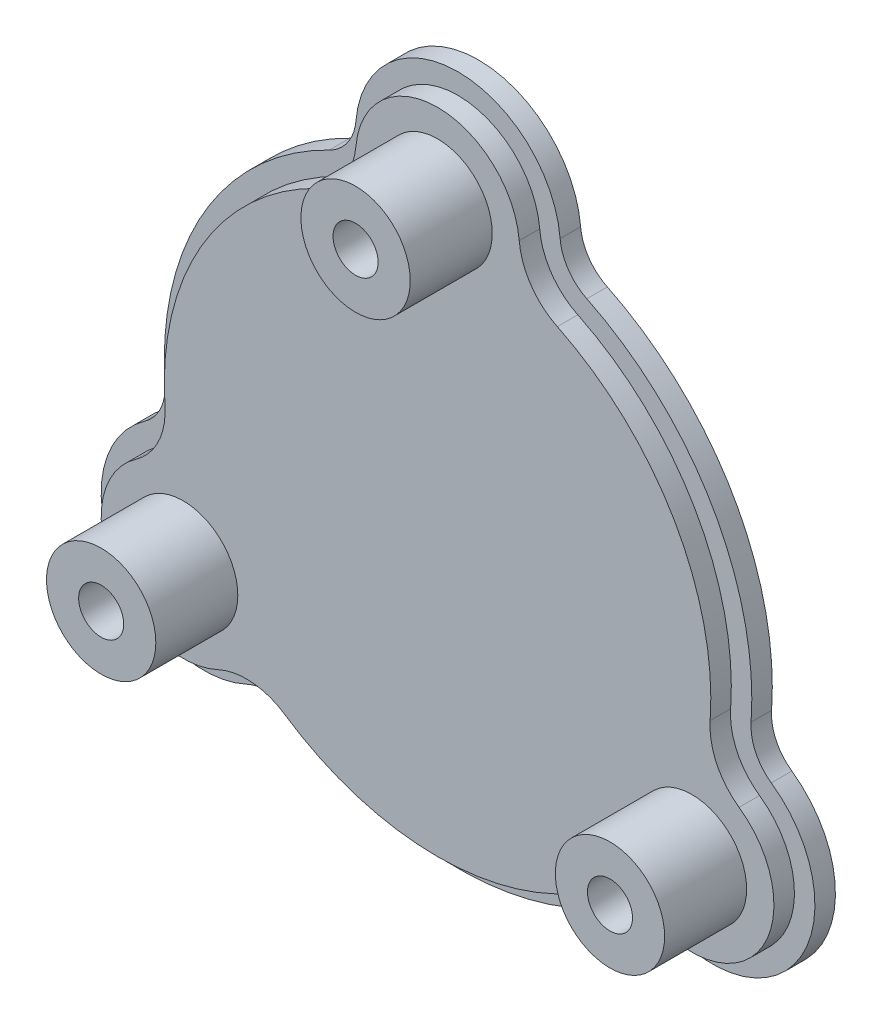
from build123d import *

# Parameters (mm, degrees)
BOSS_EXTRUDE1_DEPTH = 3
SKETCH1_3_R         = 8
BOSS_EXTRUDE2_DEPTH = 6
SKETCH1_5_R         = 8
SKETCH1_5_R_2       = 3.3
BOSS_EXTRUDE4_DEPTH = 18


with BuildPart() as part:
    # Sketch1 → Boss-Extrude1 (new body)
    with BuildSketch(Plane.XY):
        with BuildLine():
            ThreePointArc((-14.941453584, 44.323995772), (-16.147655157, 40.973517522), (-18.846153454, 38.65))
            ThreePointArc((-18.846153454, 38.65), (-37.239092363, 21.5), (-42.894958583, -3.003752345))
            ThreePointArc((-42.894958583, -3.003752345), (-43.557934635, -6.502479184), (-45.856433127, -9.222319513))
            ThreePointArc((-45.856433127, -9.222319513), (-50.229473419, -29), (-30.914979544, -35.101676259))
            ThreePointArc((-30.914979544, -35.101676259), (-27.410279478, -34.471038339), (-24.048805129, -35.646247655))
            ThreePointArc((-24.048805129, -35.646247655), (0, -43), (24.048805129, -35.646247655))
            ThreePointArc((24.048805129, -35.646247655), (27.410279478, -34.471038339), (30.914979544, -35.101676259))
            ThreePointArc((30.914979544, -35.101676259), (50.229473419, -29), (45.856433127, -9.222319513))
            ThreePointArc((45.856433127, -9.222319513), (43.557934635, -6.502479184), (42.894958583, -3.003752345))
            ThreePointArc((42.894958583, -3.003752345), (37.239092363, 21.5), (18.846153454, 38.65))
            ThreePointArc((18.846153454, 38.65), (16.147655157, 40.973517523), (14.941453584, 44.323995772))
            ThreePointArc((14.941453584, 44.323995772), (0, 58), (-14.941453584, 44.323995772))
        make_face()
        with BuildLine():
            ThreePointArc((-39.902287054, -2.794188228), (-34.641016151, 20), (-17.531305538, 35.953488372))
            ThreePointArc((-17.531305538, 35.953488372), (-13.676307972, 39.272799119), (-11.953162867, 44.059196617))
            ThreePointArc((-11.953162867, 44.059196617), (0, 55), (11.953162867, 44.059196617))
            ThreePointArc((11.953162867, 44.059196617), (13.676307972, 39.272799119), (17.531305538, 35.953488372))
            ThreePointArc((17.531305538, 35.953488372), (34.641016151, 20), (39.902287054, -2.794188228))
            ThreePointArc((39.902287054, -2.794188228), (40.8493957, -7.792369426), (44.132964974, -11.67785561))
            ThreePointArc((44.132964974, -11.67785561), (47.631397208, -27.5), (32.179802107, -32.381341007))
            ThreePointArc((32.179802107, -32.381341007), (27.173087728, -31.480429693), (22.370981516, -33.159300144))
            ThreePointArc((22.370981516, -33.159300144), (0, -40), (-22.370981516, -33.159300144))
            ThreePointArc((-22.370981516, -33.159300144), (-27.173087728, -31.480429693), (-32.179802107, -32.381341007))
            ThreePointArc((-32.179802107, -32.381341007), (-47.631397208, -27.5), (-44.132964974, -11.67785561))
            ThreePointArc((-44.132964974, -11.67785561), (-40.8493957, -7.792369426), (-39.902287054, -2.794188228))
        make_face(mode=Mode.SUBTRACT)
    extrude(amount=BOSS_EXTRUDE1_DEPTH)

    # Sketch1<3> → Boss-Extrude2 (add)
    with BuildSketch(Plane.XY):
        with BuildLine():
            ThreePointArc((-11.953162867, 44.059196617), (-13.676307972, 39.272799119), (-17.531305538, 35.953488372))
            ThreePointArc((-17.531305538, 35.953488372), (-34.641016151, 20), (-39.902287054, -2.794188228))
            ThreePointArc((-39.902287054, -2.794188228), (-40.8493957, -7.792369426), (-44.132964974, -11.67785561))
            ThreePointArc((-44.132964974, -11.67785561), (-47.631397208, -27.5), (-32.179802107, -32.381341007))
            ThreePointArc((-32.179802107, -32.381341007), (-27.173087728, -31.480429693), (-22.370981516, -33.159300144))
            ThreePointArc((-22.370981516, -33.159300144), (0, -40), (22.370981516, -33.159300144))
            ThreePointArc((22.370981516, -33.159300144), (27.173087728, -31.480429693), (32.179802107, -32.381341007))
            ThreePointArc((32.179802107, -32.381341007), (47.631397208, -27.5), (44.132964974, -11.67785561))
            ThreePointArc((44.132964974, -11.67785561), (40.8493957, -7.792369426), (39.902287054, -2.794188228))
            ThreePointArc((39.902287054, -2.794188228), (34.641016151, 20), (17.531305538, 35.953488372))
            ThreePointArc((17.531305538, 35.953488372), (13.676307972, 39.272799119), (11.953162867, 44.059196617))
            ThreePointArc((11.953162867, 44.059196617), (0, 55), (-11.953162867, 44.059196617))
        make_face()
        with Locations((-37.239092363, -21.5)):
            Circle(SKETCH1_3_R, mode=Mode.SUBTRACT)
        with Locations((37.239092363, -21.5)):
            Circle(SKETCH1_3_R, mode=Mode.SUBTRACT)
        with Locations((0, 43)):
            Circle(SKETCH1_3_R, mode=Mode.SUBTRACT)
    extrude(amount=BOSS_EXTRUDE2_DEPTH)

    # Sketch1<5> → Boss-Extrude4 (add)
    # profile 1 of 3: a face of its own
    with BuildSketch(Plane.XY):
        with Locations((0, 43)):
            Circle(SKETCH1_5_R)
        with Locations((0, 43)):
            Circle(SKETCH1_5_R_2, mode=Mode.SUBTRACT)
    # profile 2 of 3: a face of its own
    with BuildSketch(Plane.XY):
        with Locations((37.239092363, -21.5)):
            Circle(SKETCH1_5_R)
        with Locations((37.239092363, -21.5)):
            Circle(SKETCH1_5_R_2, mode=Mode.SUBTRACT)
    # profile 3 of 3: a face of its own
    with BuildSketch(Plane.XY):
        with Locations((-37.239092363, -21.5)):
            Circle(SKETCH1_5_R)
        with Locations((-37.239092363, -21.5)):
            Circle(SKETCH1_5_R_2, mode=Mode.SUBTRACT)
    extrude(amount=BOSS_EXTRUDE4_DEPTH)


solid = part.part
